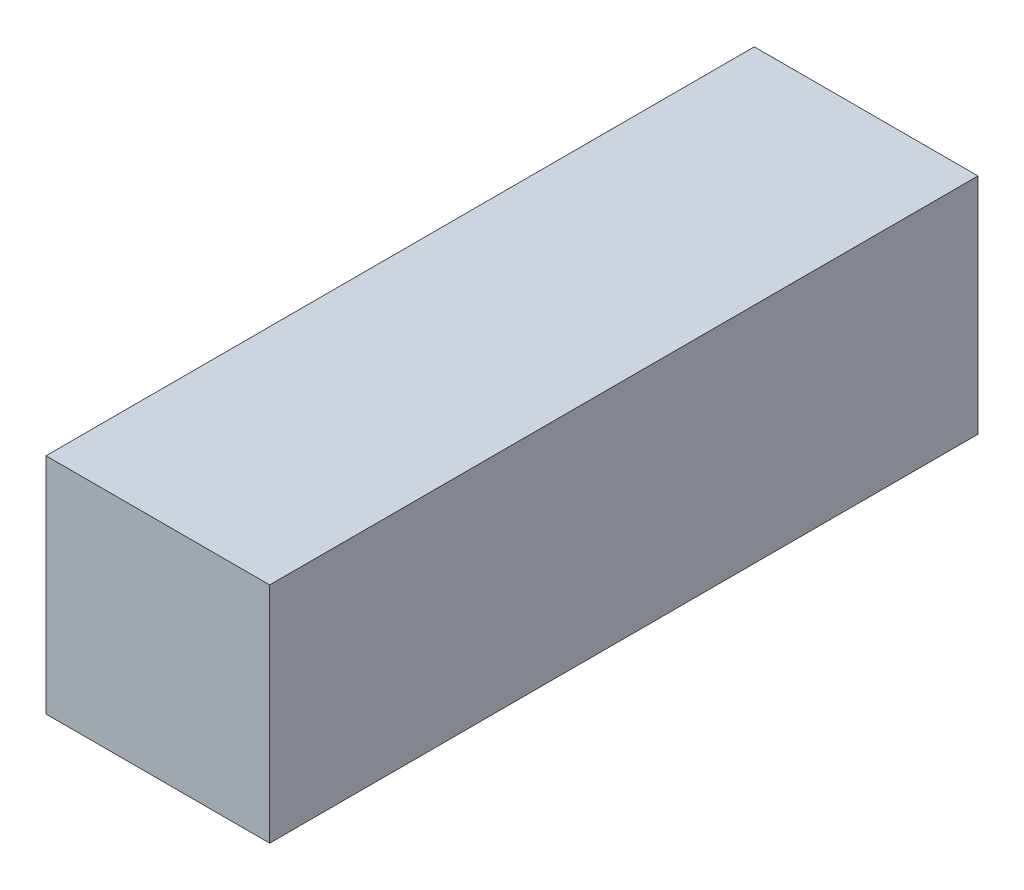
from build123d import *

# Parameters (mm, degrees)
SKETCH1_W           = 3
SKETCH1_H           = 3
BOSS_EXTRUDE1_DEPTH = 9.5


with BuildPart() as part:
    # Sketch1 → Boss-Extrude1 (new body)
    with BuildSketch(Plane.XY):
        Rectangle(SKETCH1_W, SKETCH1_H)
    extrude(amount=BOSS_EXTRUDE1_DEPTH)


solid = part.part
